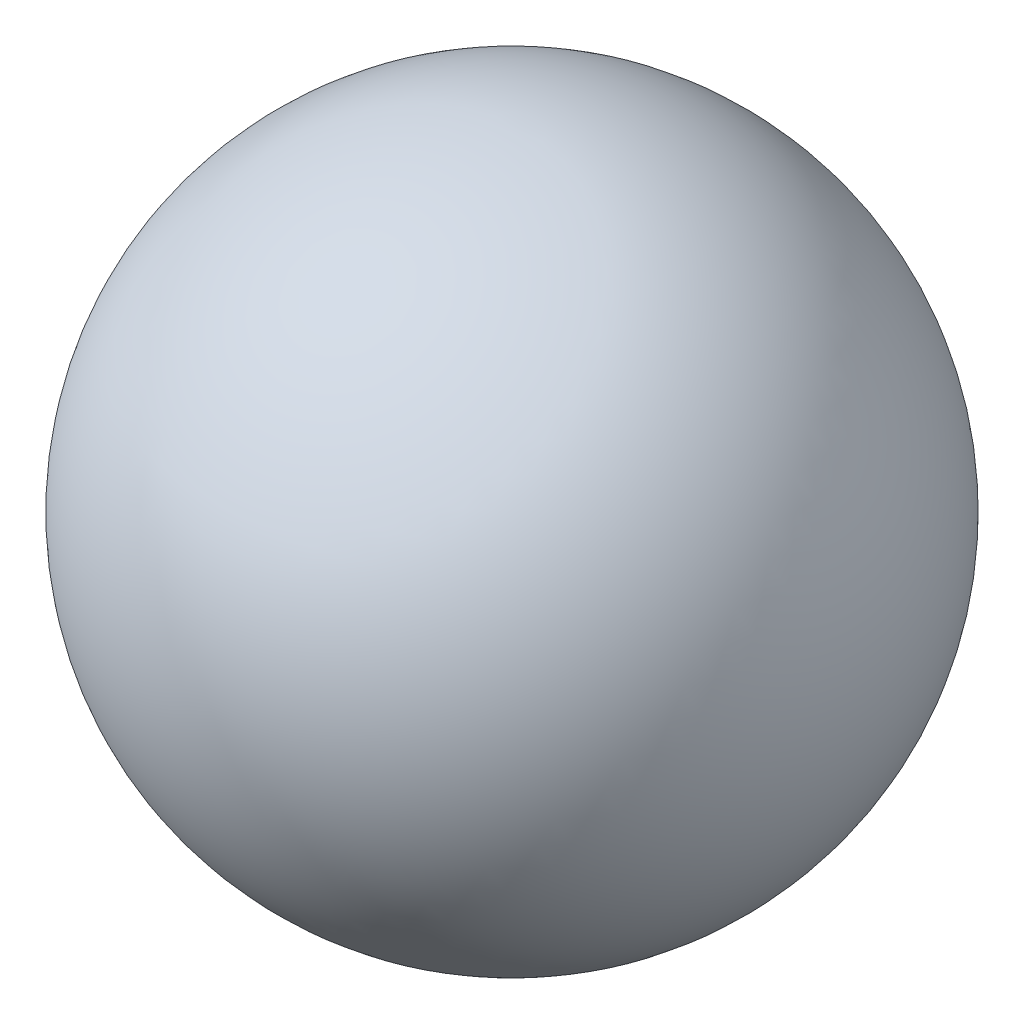
from build123d import *


with BuildPart() as part:
    # Esboço2 → Revolução1 (revolve)
    with BuildSketch(Plane.XY):
        with BuildLine():
            Line((0, 0), (0, 50))
            ThreePointArc((0, 50), (25, 25), (0, 0))
        make_face()
    revolve(axis=Axis((0, 0, 0), (0, 1, 0)))


solid = part.part
